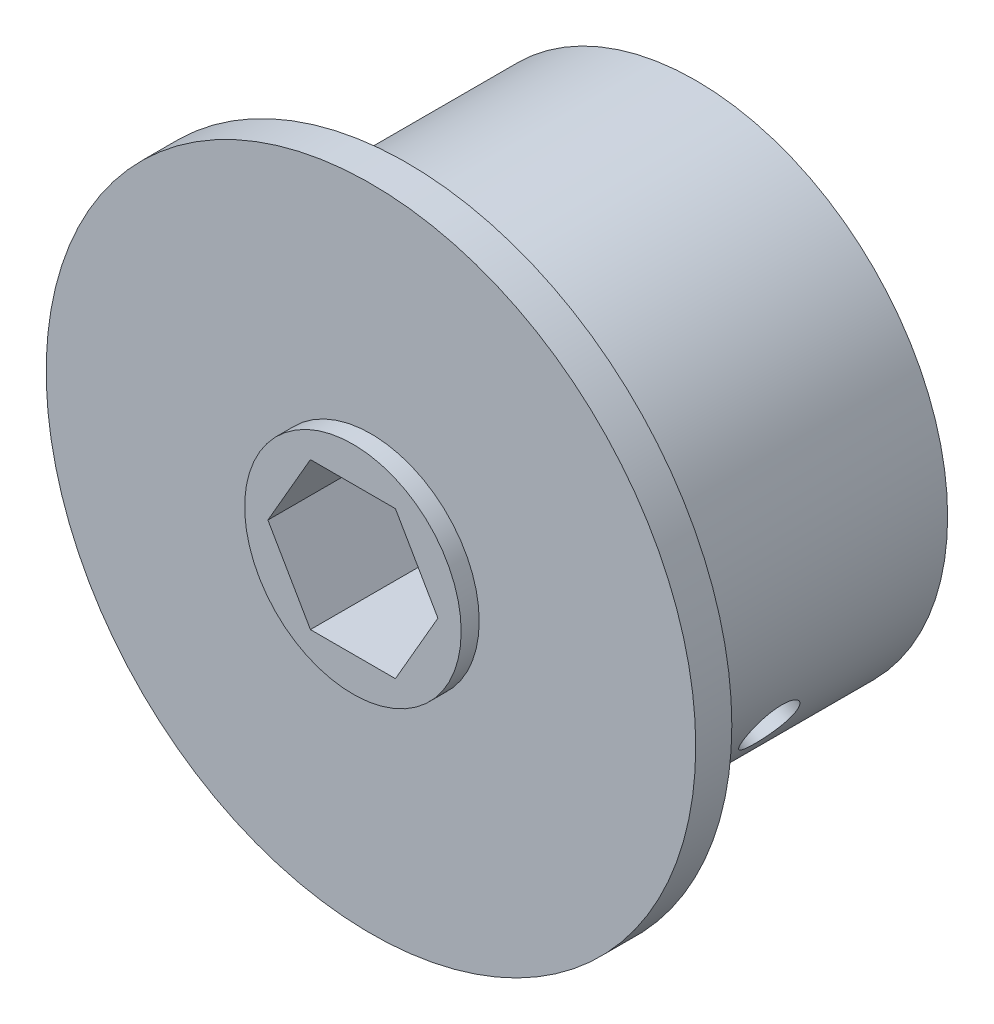
from build123d import *
from build123d.topology import SkipClean

# Parameters (mm, degrees)
SKETCH1_R           = 22.1615
BOSS_EXTRUDE1_DEPTH = 12.7
SKETCH2_R           = 28.575
BOSS_EXTRUDE2_DEPTH = 3.175
BOSS_EXTRUDE3_START = 12.7
SKETCH3_R           = 22.1615
BOSS_EXTRUDE3_DEPTH = 12.7
SKETCH5_R           = 9.525
BOSS_EXTRUDE4_DEPTH = 1.5875
SKETCH6_R           = 3.175
CUT_EXTRUDE1_DEPTH  = 17.78
SKETCH8_R           = 2.413
CUT_EXTRUDE2_DEPTH  = 21.336
CUT_EXTRUDE3_START  = -22.86
SKETCH9_R           = 2.413
CUT_EXTRUDE3_DEPTH  = 22.86
BOSS_EXTRUDE6_START = 6.35
SKETCH10_R          = 2.413
BOSS_EXTRUDE6_DEPTH = 6.35
SKETCH11_R          = 2.413
BOSS_EXTRUDE7_DEPTH = 6.35


with BuildPart() as part:
    # Sketch1 → Boss-Extrude1 (new body)
    with BuildSketch(Plane.XY):
        Circle(SKETCH1_R)
        Polygon((7.478995387, 0), (3.739497694, 6.477), (-3.739497694, 6.477), (-7.478995387, 0), (-3.739497694, -6.477), (3.739497694, -6.477), align=None, mode=Mode.SUBTRACT)
    extrude(amount=BOSS_EXTRUDE1_DEPTH)

    # Sketch2 → Boss-Extrude2 (add)
    with BuildSketch(Plane.XY.offset(12.7)):
        Circle(SKETCH2_R)
        Polygon((7.478995387, 0), (3.739497694, 6.477), (-3.739497694, 6.477), (-7.478995387, 0), (-3.739497694, -6.477), (3.739497694, -6.477), align=None, mode=Mode.SUBTRACT)
    extrude(amount=BOSS_EXTRUDE2_DEPTH)

    # Sketch3 → Boss-Extrude3 (add)
    with BuildSketch(Plane(origin=(0, 0, 0), x_dir=(-1, 0, 0), z_dir=(0, 0, -1)).offset(BOSS_EXTRUDE3_START)):
        Circle(SKETCH3_R)
    extrude(amount=-BOSS_EXTRUDE3_DEPTH)

    # Sketch5 → Boss-Extrude4 (add)
    with BuildSketch(Plane.XY.offset(15.875)):
        Circle(SKETCH5_R)
        Polygon((7.478995387, 0), (3.739497694, 6.477), (-3.739497694, 6.477), (-7.478995387, 0), (-3.739497694, -6.477), (3.739497694, -6.477), align=None, mode=Mode.SUBTRACT)
    extrude(amount=BOSS_EXTRUDE4_DEPTH)

    # Sketch6 → Cut-Extrude1 (cut)
    with BuildSketch(Plane.XY):
        Circle(SKETCH6_R)
    extrude(amount=-CUT_EXTRUDE1_DEPTH, mode=Mode.SUBTRACT)

    # Sketch8 → Cut-Extrude2 (cut)
    with BuildSketch(Plane(origin=(5.60924654, -3.2385, 0), x_dir=(0, 0, 1), z_dir=(-0.8660254037844389, 0.4999999999999997, 0))):
        with Locations(Location((0, 0, 0), (0, 0, 270))):
            Circle(SKETCH8_R)
    extrude(amount=-CUT_EXTRUDE2_DEPTH, mode=Mode.SUBTRACT)

    # Sketch9 → Cut-Extrude3 (cut)
    with SkipClean():  # the faces are left unmerged after this step: merging them gives an invalid solid
        with BuildSketch(Plane(origin=(-5.60924654, 3.2385, 0), x_dir=(0, 0, -1), z_dir=(0.8660254037844386, -0.5000000000000001, 0)).offset(CUT_EXTRUDE3_START)):
            with Locations(Location((0, 0, 0), (0, 0, 270))):
                Circle(SKETCH9_R)
        extrude(amount=CUT_EXTRUDE3_DEPTH, mode=Mode.SUBTRACT)

    # Sketch10 → Boss-Extrude6 (add)
    with SkipClean():  # the faces are left unmerged after this step: merging them gives an invalid solid
        with BuildSketch(Plane(origin=(-5.60924654, 3.2385, 0), x_dir=(0, 0, 1), z_dir=(-0.8660254037844386, 0.5000000000000001, 0)).offset(BOSS_EXTRUDE6_START)):
            with Locations(Location((0, 0, 0), (0, 0, 270))):
                Circle(SKETCH10_R)
        extrude(amount=-BOSS_EXTRUDE6_DEPTH)

    # Sketch11 → Boss-Extrude7 (add)
    with SkipClean():  # the faces are left unmerged after this step: merging them gives an invalid solid
        with BuildSketch(Plane(origin=(5.60924654, -3.2385, 0), x_dir=(0, 0, -1), z_dir=(0.8660254037844388, -0.49999999999999983, 0))):
            with Locations(Location((0, 0, 0), (0, 0, 270))):
                Circle(SKETCH11_R)
        extrude(amount=BOSS_EXTRUDE7_DEPTH)


solid = part.part
